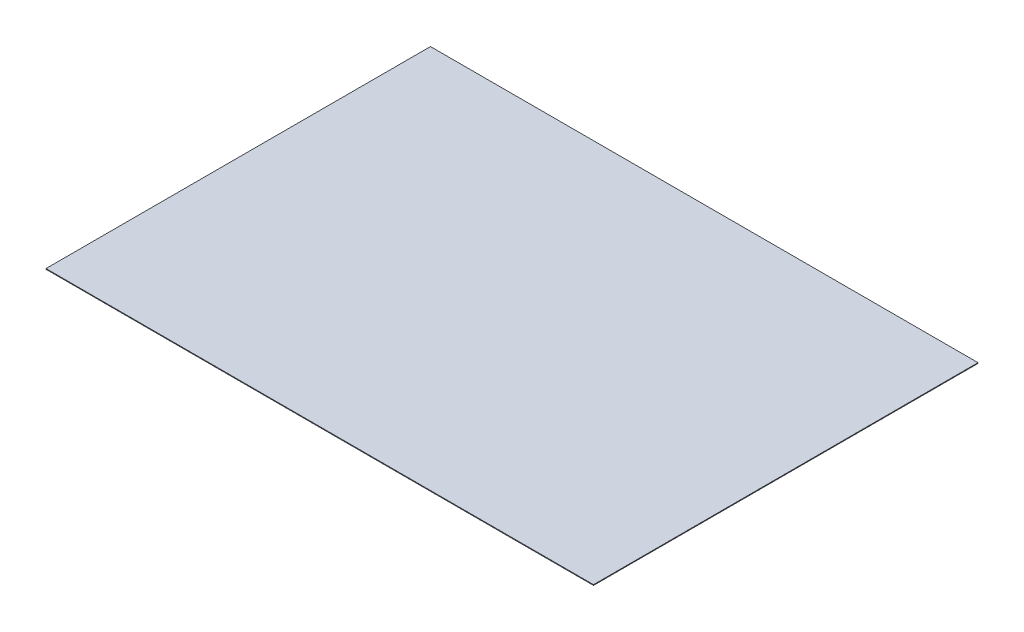
from build123d import *

# Parameters (mm, degrees)
CROQUIS1_W     = 1566.5
CROQUIS1_H     = 1100
EXTRUIR1_DEPTH = 2


with BuildPart() as part:
    # Croquis1 → Extruir1 (new body)
    with BuildSketch(Plane(origin=(0, 0, 0), x_dir=(1, 0, 0), z_dir=(0, 1, 0))):
        Rectangle(CROQUIS1_W, CROQUIS1_H)
    extrude(amount=EXTRUIR1_DEPTH)


solid = part.part
